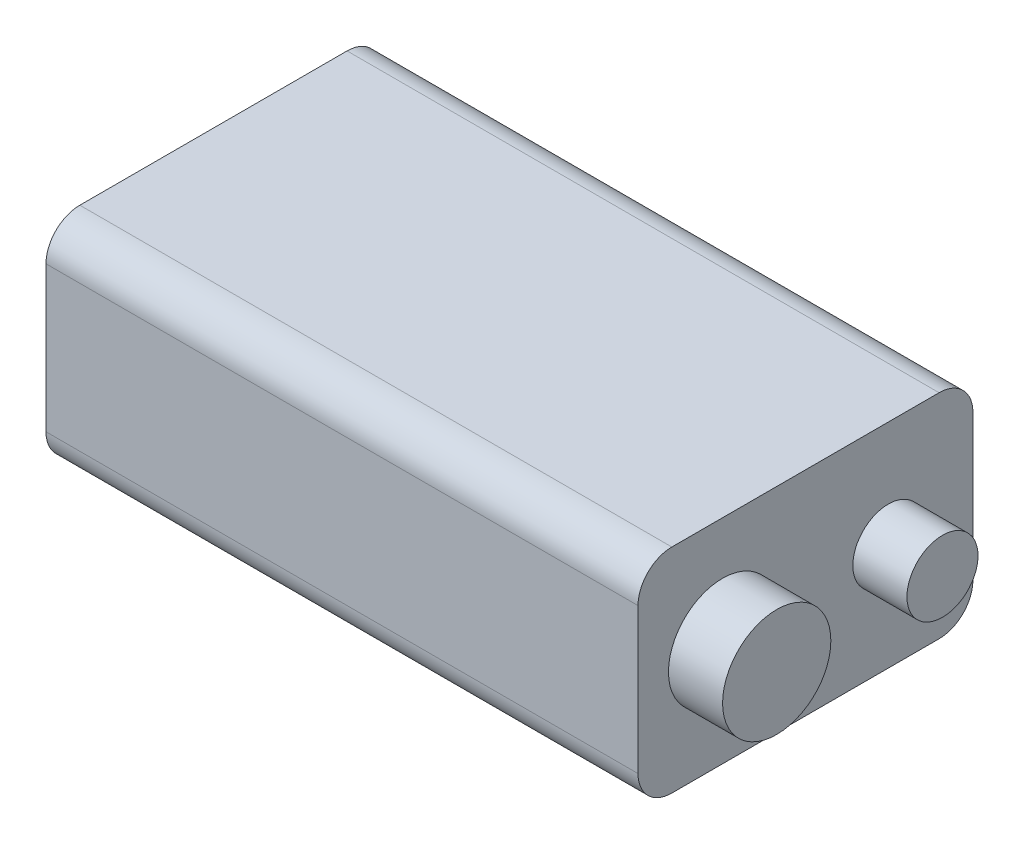
from build123d import *

# Parameters (mm, degrees)
SKETCH1_W           = 44.45
SKETCH1_H           = 25.146
BOSS_EXTRUDE1_DEPTH = 16.002
FILLET1_R           = 2.54
SKETCH2_R           = 4.064
SKETCH2_R_2         = 2.667
BOSS_EXTRUDE2_DEPTH = 4.064


with BuildPart() as part:
    # Sketch1 → Boss-Extrude1 (new body)
    with BuildSketch(Plane(origin=(0, 0, 0), x_dir=(1, 0, 0), z_dir=(0, 1, 0))):
        Rectangle(SKETCH1_W, SKETCH1_H)
    extrude(amount=BOSS_EXTRUDE1_DEPTH)

    # Fillet1
    fillet1_edges = [part.edges().sort_by_distance(p)[0] for p in [
        (0, 16.002, 12.573),
        (0, 0, 12.573),
        (0, 0, -12.573),
        (0, 16.002, -12.573),
    ]]
    fillet(fillet1_edges, radius=FILLET1_R)

    # Sketch2 → Boss-Extrude2 (add)
    with BuildSketch(Plane(origin=(22.225, 0, 0), x_dir=(0, 0, -1), z_dir=(1, 0, 0))):
        with Locations(Location((-6.223, 8.001, 0), (0, 0, 180))):
            Circle(SKETCH2_R)
        with Locations(Location((6.223, 8.001, 0), (0, 0, 180))):
            Circle(SKETCH2_R_2)
    extrude(amount=BOSS_EXTRUDE2_DEPTH)


solid = part.part
